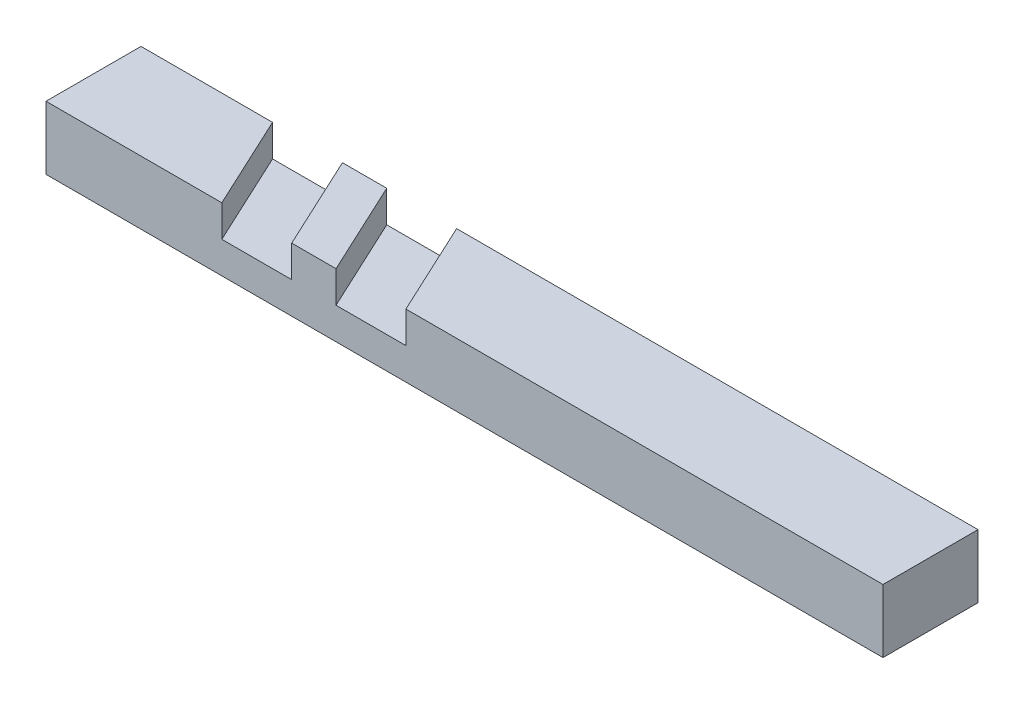
from build123d import *

# Parameters (mm, degrees)
SKETCH1_W           = 132.14490548
SKETCH1_H           = 15
BOSS_EXTRUDE1_DEPTH = 5
BOSS_EXTRUDE2_DEPTH = 5


with BuildPart() as part:
    # Sketch1 → Boss-Extrude1 (new body)
    with BuildSketch(Plane(origin=(0, 0, 0), x_dir=(1, 0, 0), z_dir=(0, 1, 0))):
        with Locations((-64.5826857, 7.5)):
            Rectangle(SKETCH1_W, SKETCH1_H)
    extrude(amount=-BOSS_EXTRUDE1_DEPTH)

    # Sketch1<3> → Boss-Extrude2 (add)
    with BuildSketch(Plane(origin=(0, 0, 0), x_dir=(1, 0, 0), z_dir=(0, 1, 0))):
        Polygon((-109.888174915, 15), (-130.65513844, 15), (-130.65513844, 0), (-102.893560042, 0), align=None)
        Polygon((-91.859780853, 15), (-98.854395725, 15), (-91.859780853, 0), (-84.86516598, 0), align=None)
        Polygon((1.48976704, 15), (-80.826001663, 15), (-73.831386791, 0), (1.48976704, 0), align=None)
    extrude(amount=BOSS_EXTRUDE2_DEPTH)


solid = part.part
